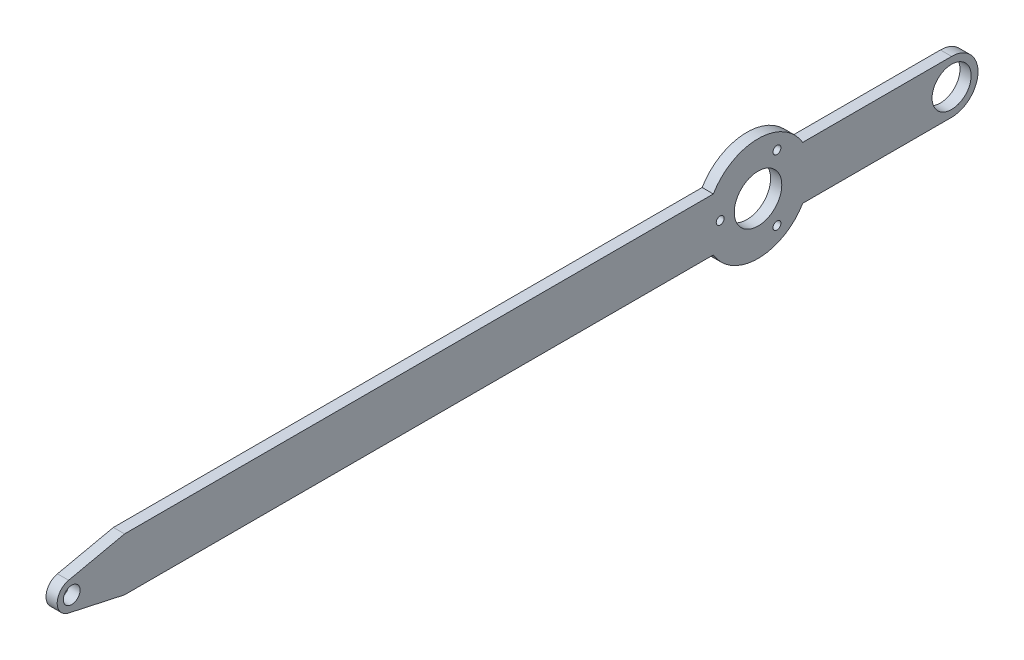
from build123d import *

# Parameters (mm, degrees)
SKETCH1_R            = 4.7625
SKETCH1_R_2          = 13.5
SKETCH1_R_3          = 11.1125
BOSS_EXTRUDE1_DEPTH  = 3.175
M4_CLEARANCE_HOLE1_D = 4.5


with BuildPart() as part:
    # Sketch1 → Boss-Extrude1 (new, symmetric)
    # profile 1 of 5: a face of its own
    with BuildSketch(Plane(origin=(0, 0, 0), x_dir=(0, 0, -1), z_dir=(1, 0, 0))):
        with BuildLine():
            Line((-135.401771592, 15), (-470, 15))
            Line((-470, 15), (-501.760727799, 8.072716015))
            ThreePointArc((-501.760727799, 8.072716015), (-508.2625, 0), (-501.760727799, -8.072716015))
            Line((-501.760727799, -8.072716015), (-470, -15))
            Line((-470, -15), (-135.401771592, -15))
            ThreePointArc((-135.401771592, -15), (-139.5, 0), (-135.401771592, 15))
        make_face()
        with Locations((-500, 0)):
            Circle(SKETCH1_R, mode=Mode.SUBTRACT)
    # profile 2 of 5: a face of its own
    with BuildSketch(Plane(origin=(0, 0, 0), x_dir=(0, 0, -1), z_dir=(1, 0, 0))):
        with BuildLine():
            Line((-84.598228408, -15), (-135.401771592, -15))
            ThreePointArc((-135.401771592, -15), (-110, -29.5), (-84.598228408, -15))
        make_face()
    # profile 3 of 5: a face of its own
    with BuildSketch(Plane(origin=(0, 0, 0), x_dir=(0, 0, -1), z_dir=(1, 0, 0))):
        with BuildLine():
            Line((-84.598228408, 15), (-135.401771592, 15))
            ThreePointArc((-135.401771592, 15), (-139.5, 0), (-135.401771592, -15))
            Line((-135.401771592, -15), (-84.598228408, -15))
            ThreePointArc((-84.598228408, -15), (-81.542995046, -7.774887075), (-80.5, 0))
            ThreePointArc((-80.5, 0), (-81.542995046, 7.774887075), (-84.598228408, 15))
        make_face()
        with Locations((-110, 0)):
            Circle(SKETCH1_R_2, mode=Mode.SUBTRACT)
    # profile 4 of 5: a face of its own
    with BuildSketch(Plane(origin=(0, 0, 0), x_dir=(0, 0, -1), z_dir=(1, 0, 0))):
        with BuildLine():
            ThreePointArc((-84.598228408, 15), (-110, 29.5), (-135.401771592, 15))
            Line((-135.401771592, 15), (-84.598228408, 15))
        make_face()
    # profile 5 of 5: a face of its own
    with BuildSketch(Plane(origin=(0, 0, 0), x_dir=(0, 0, -1), z_dir=(1, 0, 0))):
        with BuildLine():
            Line((0, 15), (-84.598228408, 15))
            ThreePointArc((-84.598228408, 15), (-81.542995046, 7.774887075), (-80.5, 0))
            ThreePointArc((-80.5, 0), (-81.542995046, -7.774887075), (-84.598228408, -15))
            Line((-84.598228408, -15), (0, -15))
            ThreePointArc((0, -15), (15, 0), (0, 15))
        make_face()
        Circle(SKETCH1_R_3, mode=Mode.SUBTRACT)
    extrude(amount=BOSS_EXTRUDE1_DEPTH, both=True)

    # M4 Clearance Hole1 (through all)
    with Locations(Plane(origin=(3.175, 0, 0), x_dir=(0, 0, -1), z_dir=(1, 0, 0))):
        with Locations((-110, 0), (-131.5, 0), (-99.25, 18.619546181), (-99.25, -18.619546181)):
            Hole(M4_CLEARANCE_HOLE1_D / 2)


solid = part.part
